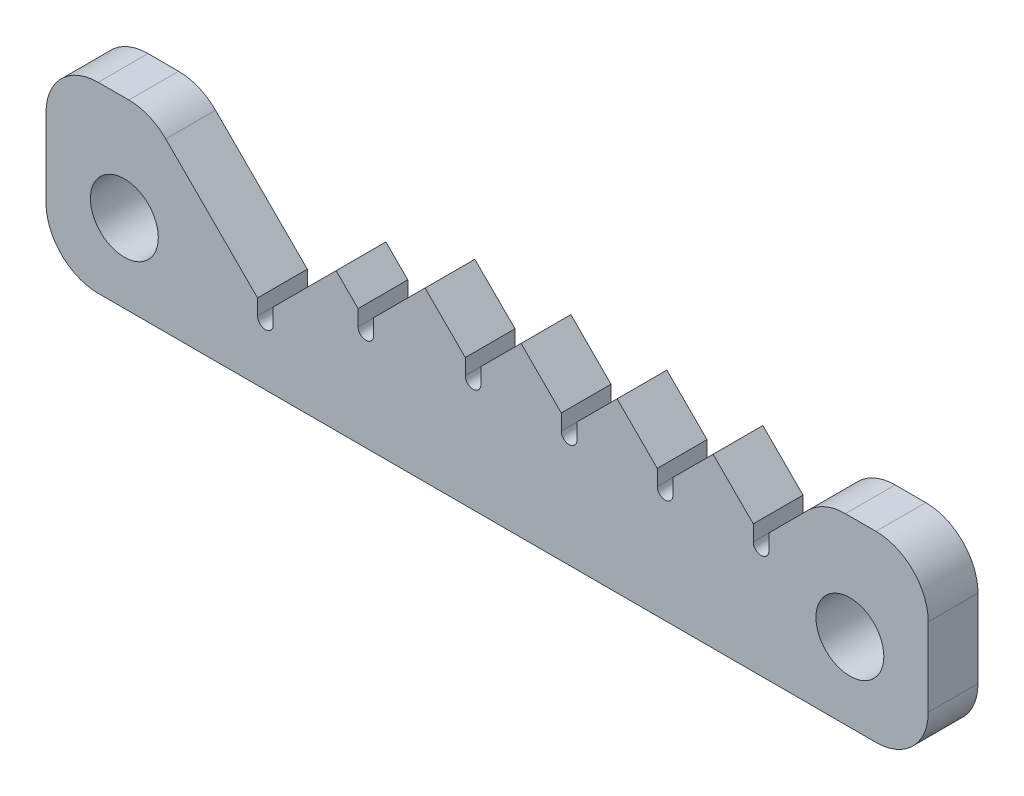
from build123d import *

# Parameters (mm, degrees)
CROQUIS9_R              = 6.5
SALIENTE_EXTRUIR1_DEPTH = 4.765
REDONDEO1_R             = 10


with BuildPart() as part:
    # Croquis9 → Saliente-Extruir1 (new, symmetric)
    with BuildSketch(Plane.XY):
        with BuildLine():
            Line((-5, 20), (-15.5, 9.5))
            Line((-15.5, 9.5), (-15.5, 6.5))
            ThreePointArc((-15.5, 6.5), (-17, 5), (-18.5, 6.5))
            Line((-18.5, 6.5), (-18.5, 9.5))
            Line((-18.5, 9.5), (-26.19, 17.19))
            Line((-26.19, 17.19), (-33.88, 9.5))
            Line((-33.88, 9.5), (-33.88, 6.5))
            ThreePointArc((-33.88, 6.5), (-35.38, 5), (-36.88, 6.5))
            Line((-36.88, 6.5), (-36.88, 9.5))
            Line((-36.88, 9.5), (-44.57, 17.19))
            Line((-44.57, 17.19), (-52.26, 9.5))
            Line((-52.26, 9.5), (-52.26, 6.5))
            ThreePointArc((-52.26, 6.5), (-53.76, 5), (-55.26, 6.5))
            Line((-55.26, 6.5), (-55.26, 9.5))
            Line((-55.26, 9.5), (-62.95, 17.19))
            Line((-62.95, 17.19), (-70.64, 9.5))
            Line((-70.64, 9.5), (-70.64, 6.5))
            ThreePointArc((-70.64, 6.5), (-72.14, 5), (-73.64, 6.5))
            Line((-73.64, 6.5), (-73.64, 9.5))
            Line((-73.64, 9.5), (-81.33, 17.19))
            Line((-81.33, 17.19), (-91.169058454, 7.350941546))
            Line((-91.169058454, 7.350941546), (-91.169058454, 4.350941546))
            ThreePointArc((-91.169058454, 4.350941546), (-92.669058454, 2.850941546), (-94.169058454, 4.350941546))
            Line((-94.169058454, 4.350941546), (-94.169058454, 7.350941546))
            Line((-94.169058454, 7.350941546), (-98.364058454, 11.545941546))
            Line((-98.364058454, 11.545941546), (-110.41, -0.5))
            Line((-110.41, -0.5), (-110.41, -3.5))
            ThreePointArc((-110.41, -3.5), (-111.91, -5), (-113.41, -3.5))
            Line((-113.41, -3.5), (-113.41, -0.5))
            Line((-113.41, -0.5), (-133.91, 20))
            Line((-133.91, 20), (-153.91, 20))
            Line((-153.91, 20), (-153.91, -15))
            Line((-153.91, -15), (15, -15))
            Line((15, -15), (15, 20))
            Line((15, 20), (-5, 20))
        make_face()
        with Locations((-138.91, 0)):
            Circle(CROQUIS9_R, mode=Mode.SUBTRACT)
        Circle(CROQUIS9_R, mode=Mode.SUBTRACT)
    extrude(amount=SALIENTE_EXTRUIR1_DEPTH, both=True)

    # Redondeo1
    redondeo1_edges = [part.edges().sort_by_distance(p)[0] for p in [
        (15, 20, 0),
        (15, -15, 0),
        (-153.91, -15, 0),
        (-153.91, 20, 0),
        (-133.91, 20, 0),
        (-5, 20, 0),
    ]]
    fillet(redondeo1_edges, radius=REDONDEO1_R)


solid = part.part
